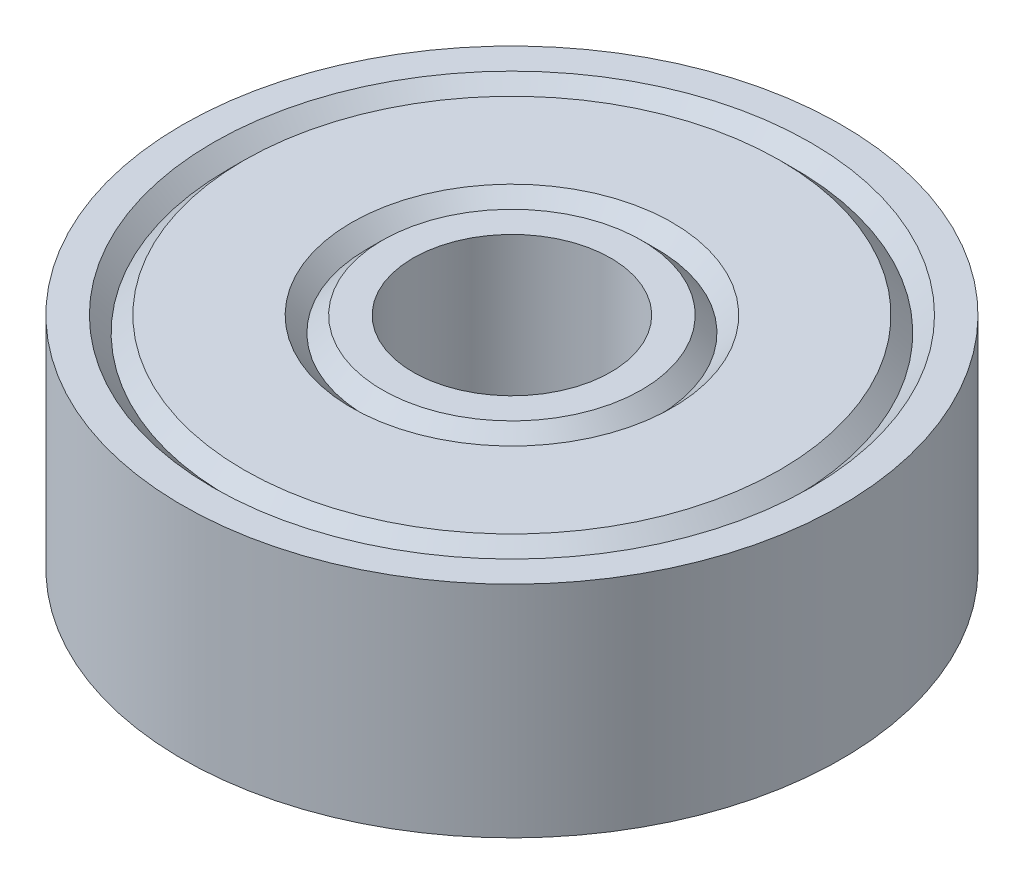
from build123d import *


with BuildPart() as part:
    # Sketch1 → Revolve1 (revolve)
    with BuildSketch(Plane.XY):
        Polygon((-4.5, 5), (-5.9, 5), (-6.6, 4.3), (-7.3, 5), (-12.2, 5), (-12.9, 4.3), (-13.6, 5), (-15, 5), (-15, -5), (-13.6, -5), (-12.9, -4.3), (-12.2, -5), (-7.3, -5), (-6.6, -4.3), (-5.9, -5), (-4.5, -5), align=None)
    revolve(axis=Axis((0, 5, 0), (0, -1, 0)))


solid = part.part
